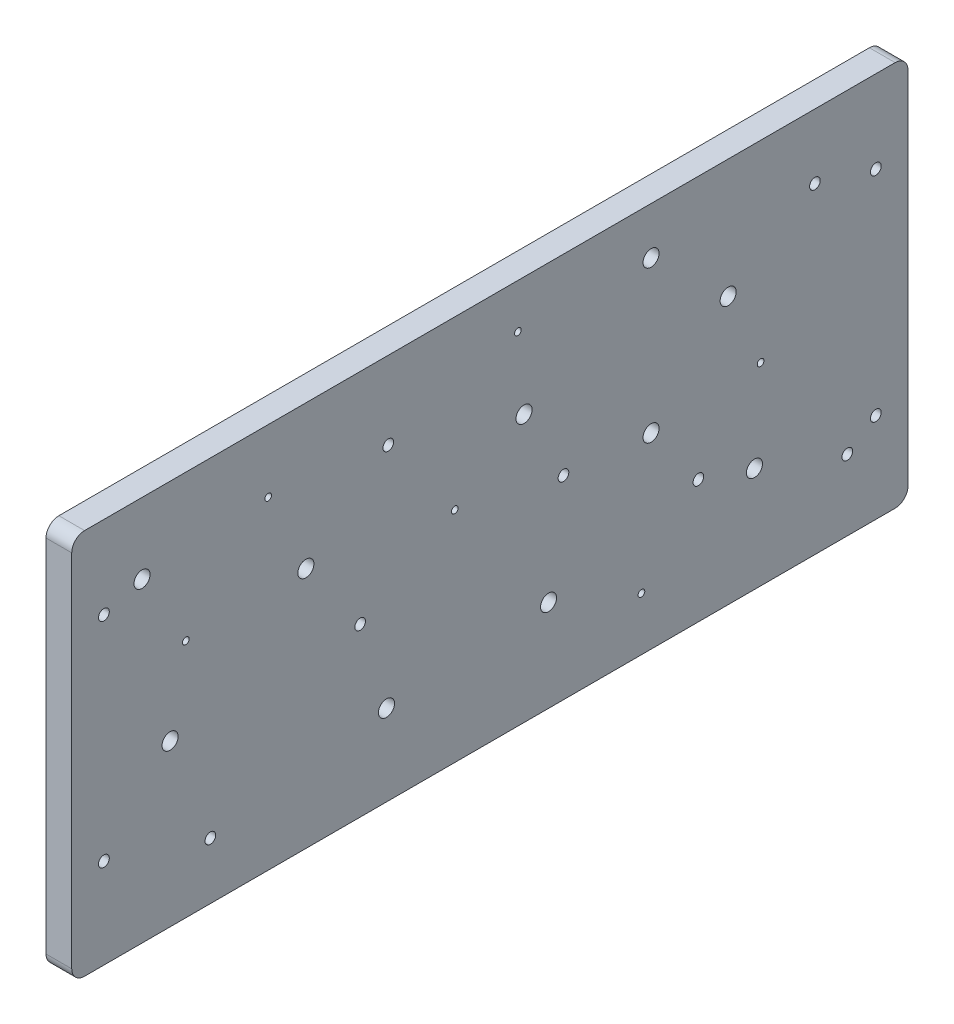
from build123d import *

# Parameters (mm, degrees)
SKETCH1_W                    = 650
SKETCH1_H                    = 300
BOSS_EXTRUDE1_DEPTH          = 20
FILLET1_R                    = 10
F_12_5_12_5_DIAMETER_HOLE1_D = 12.5
F_8_3_8_3_DIAMETER_HOLE1_D   = 8.3
F_5_2_5_2_DIAMETER_HOLE1_D   = 5.2
M8_CLEARANCE_HOLE1_D         = 8.4


with BuildPart() as part:
    # Sketch1 → Boss-Extrude1 (new body)
    with BuildSketch(Plane(origin=(0, 0, 0), x_dir=(0, 0, -1), z_dir=(1, 0, 0))):
        with Locations((325, 150)):
            Rectangle(SKETCH1_W, SKETCH1_H)
    extrude(amount=BOSS_EXTRUDE1_DEPTH)

    # Fillet1
    fillet1_edges = [part.edges().sort_by_distance(p)[0] for p in [
        (10, 300, 0),
        (10, 300, -650),
        (10, 0, -650),
        (10, 0, 0),
    ]]
    fillet(fillet1_edges, radius=FILLET1_R)

    # Ø12.5 (12.5) Diameter Hole1 (through all)
    with Locations(Plane(origin=(20, 0, 0), x_dir=(0, 0, -1), z_dir=(1, 0, 0))):
        with Locations((54.646833709, 244.998152891), (530.659083677, 81.560470498), (510.229373378, 207.543684009), (244.64313949, 63.173731229), (181.992027906, 188.475954397), (351.558623389, 207.543684009), (370.626353001, 71.345615349), (76.438524695, 125.143852469), (450.302223168, 145.573562769), (450.302223168, 263.38489216)):
            Hole(F_12_5_12_5_DIAMETER_HOLE1_D / 2)

    # Ø8.3 (8.3) Diameter Hole1 (through all)
    with Locations(Plane(origin=(20, 0, 0), x_dir=(0, 0, -1), z_dir=(1, 0, 0))):
        with Locations((107.764080486, 44.106001616), (224.213429191, 129.910784873), (246.005120177, 239.550230144), (487.075701706, 95.861267707), (382.203188837, 151.021485515), (577.647417365, 249.765085294), (602.844060068, 55.001847109)):
            Hole(F_8_3_8_3_DIAMETER_HOLE1_D / 2)

    # Ø5.2 (5.2) Diameter Hole1 (through all)
    with Locations(Plane(origin=(20, 0, 0), x_dir=(0, 0, -1), z_dir=(1, 0, 0))):
        with Locations((152.709443144, 251.12706598), (88.696350874, 186.432983367), (297.760386268, 170.089215127), (346.791690986, 265.42786319), (535.426016081, 150.340495172), (442.811329391, 41.382040243)):
            Hole(F_5_2_5_2_DIAMETER_HOLE1_D / 2)

    # M8 Clearance Hole1 (through all)
    with Locations(Plane.ZY):
        with Locations((-625, 235.86), (-625, 70), (-25, 70), (-25, 235.86)):
            Hole(M8_CLEARANCE_HOLE1_D / 2)


solid = part.part
